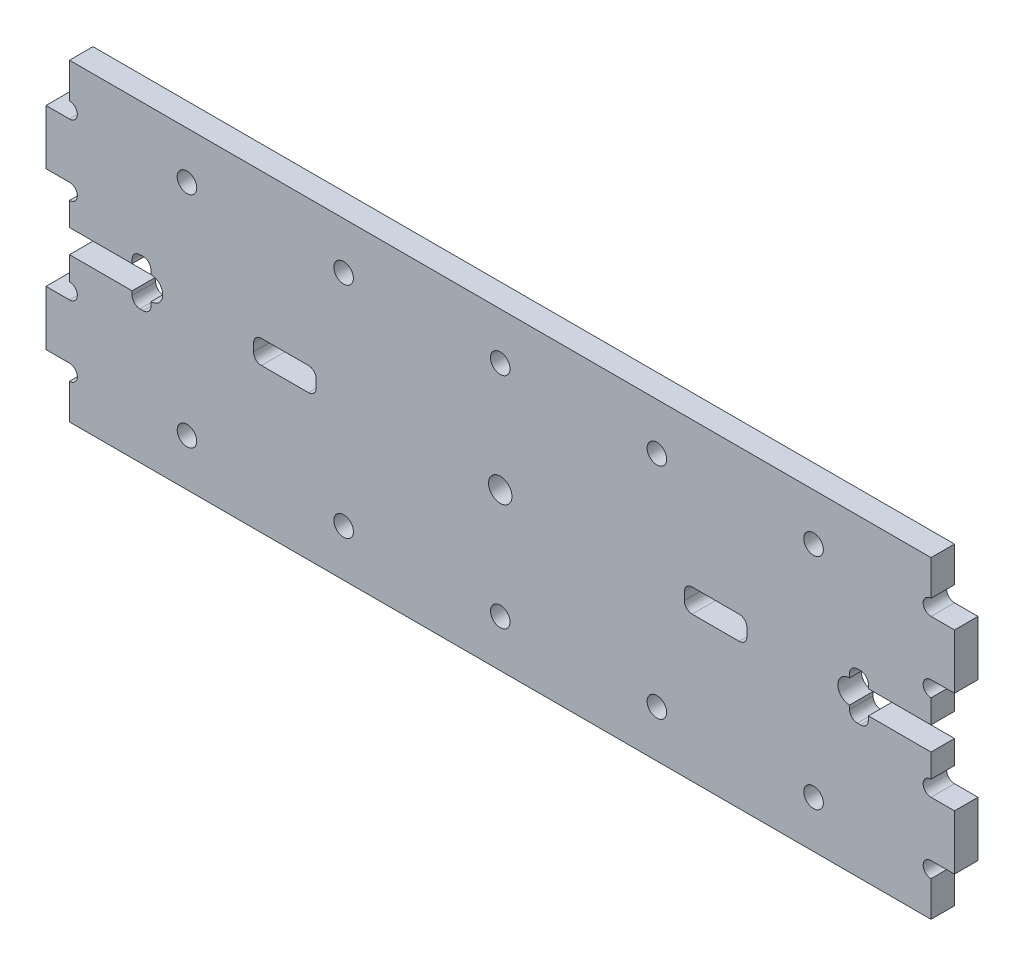
from build123d import *

# Parameters (mm, degrees)
SKETCH1_W           = 110
SKETCH1_H           = 40
BOSS_EXTRUDE1_DEPTH = 3
BOSS_EXTRUDE2_DEPTH = 3
SKETCH3_R           = 1.5
CUT_EXTRUDE1_DEPTH  = 3
SKETCH4_W           = 8
SKETCH4_H           = 3
SKETCH4_W_2         = 2.4
SKETCH4_H_2         = 6
CUT_EXTRUDE2_DEPTH  = 3
FILLET6_R           = 1
SKETCH5_W           = 8
SKETCH5_H           = 3
CUT_EXTRUDE3_DEPTH  = 10
FILLET7_R           = 1
SKETCH6_R           = 1.25
CUT_EXTRUDE4_DEPTH  = 62.424750712


with BuildPart() as part:
    # Sketch1 → Boss-Extrude1 (new body)
    with BuildSketch(Plane.XY):
        Rectangle(SKETCH1_W, SKETCH1_H)
    extrude(amount=BOSS_EXTRUDE1_DEPTH)

    # Sketch2 → Boss-Extrude2 (add)
    with BuildSketch(Plane.XY.offset(3)):
        Polygon((58, 10), (58, 13.5), (55, 13.5), (55, 6.5), (58, 6.5), align=None)
        Polygon((55, -10), (55, -6.5), (58, -6.5), (58, -13.5), (55, -13.5), align=None)
        Polygon((-55, 6.5), (-55, 13.5), (-58, 13.5), (-58, 10), (-58, 6.5), align=None)
        Polygon((-55, -13.5), (-55, -10), (-55, -6.5), (-58, -6.5), (-58, -13.5), align=None)
    extrude(amount=-BOSS_EXTRUDE2_DEPTH)

    # Sketch3 → Cut-Extrude1 (cut)
    with BuildSketch(Plane.XY.offset(3)):
        with BuildLine():
            ThreePointArc((-55, -15.5), (-54.292893219, -15.207106781), (-54, -14.5))
            ThreePointArc((-54, -14.5), (-54.292893219, -13.792893219), (-55, -13.5))
            Line((-55, -13.5), (-55, -15.5))
        make_face()
        with BuildLine():
            Line((-55, -15.5), (-55, -13.5))
            ThreePointArc((-55, -13.5), (-56, -14.5), (-55, -15.5))
        make_face()
        with BuildLine():
            ThreePointArc((-54, -5.5), (-54.292893219, -4.792893219), (-55, -4.5))
            Line((-55, -4.5), (-55, -6.5))
            ThreePointArc((-55, -6.5), (-54.292893219, -6.207106781), (-54, -5.5))
        make_face()
        with BuildLine():
            Line((-55, -6.5), (-55, -4.5))
            ThreePointArc((-55, -4.5), (-56, -5.5), (-55, -6.5))
        make_face()
        with BuildLine():
            ThreePointArc((-55, 4.5), (-54.292893219, 4.792893219), (-54, 5.5))
            ThreePointArc((-54, 5.5), (-54.292893219, 6.207106781), (-55, 6.5))
            Line((-55, 6.5), (-55, 4.5))
        make_face()
        with BuildLine():
            Line((-55, 4.5), (-55, 6.5))
            ThreePointArc((-55, 6.5), (-56, 5.5), (-55, 4.5))
        make_face()
        with BuildLine():
            Line((-55, 15.5), (-55, 13.5))
            ThreePointArc((-55, 13.5), (-54.292893219, 13.792893219), (-54, 14.5))
            ThreePointArc((-54, 14.5), (-54.292893219, 15.207106781), (-55, 15.5))
        make_face()
        with BuildLine():
            ThreePointArc((-55, 15.5), (-56, 14.5), (-55, 13.5))
            Line((-55, 13.5), (-55, 15.5))
        make_face()
        Circle(SKETCH3_R)
        with BuildLine():
            ThreePointArc((56, -5.5), (55.707106781, -4.792893219), (55, -4.5))
            Line((55, -4.5), (55, -6.5))
            ThreePointArc((55, -6.5), (55.707106781, -6.207106781), (56, -5.5))
        make_face()
        with BuildLine():
            Line((55, -6.5), (55, -4.5))
            ThreePointArc((55, -4.5), (54, -5.5), (55, -6.5))
        make_face()
        with BuildLine():
            ThreePointArc((55, -15.5), (55.707106781, -15.207106781), (56, -14.5))
            ThreePointArc((56, -14.5), (55.707106781, -13.792893219), (55, -13.5))
            Line((55, -13.5), (55, -15.5))
        make_face()
        with BuildLine():
            Line((55, -15.5), (55, -13.5))
            ThreePointArc((55, -13.5), (54, -14.5), (55, -15.5))
        make_face()
        with BuildLine():
            ThreePointArc((55, 4.5), (55.707106781, 4.792893219), (56, 5.5))
            ThreePointArc((56, 5.5), (55.707106781, 6.207106781), (55, 6.5))
            Line((55, 6.5), (55, 4.5))
        make_face()
        with BuildLine():
            Line((55, 4.5), (55, 6.5))
            ThreePointArc((55, 6.5), (54, 5.5), (55, 4.5))
        make_face()
        with BuildLine():
            Line((55, 15.5), (55, 13.5))
            ThreePointArc((55, 13.5), (55.707106781, 13.792893219), (56, 14.5))
            ThreePointArc((56, 14.5), (55.707106781, 15.207106781), (55, 15.5))
        make_face()
        with BuildLine():
            ThreePointArc((55, 15.5), (54, 14.5), (55, 13.5))
            Line((55, 13.5), (55, 15.5))
        make_face()
    extrude(amount=-CUT_EXTRUDE1_DEPTH, mode=Mode.SUBTRACT)

    # Sketch4 → Cut-Extrude2 (cut)
    with BuildSketch(Plane.XY.offset(3)):
        with Locations((-51, 0)):
            Rectangle(SKETCH4_W, SKETCH4_H)
        Polygon((-47, 3), (-47, 1.5), (-47, -1.5), (-47, -3), (-44.6, -3), (-44.6, -1.5), (-44.6, 1.5), (-44.6, 3), align=None)
        with BuildLine():
            ThreePointArc((-44.6, -1.5), (-43.1, 0), (-44.6, 1.5))
            Line((-44.6, 1.5), (-44.6, -1.5))
        make_face()
        with Locations((45.8, 0)):
            Rectangle(SKETCH4_W_2, SKETCH4_H_2)
        with BuildLine():
            Line((44.6, -1.5), (44.6, 1.5))
            ThreePointArc((44.6, 1.5), (43.1, 0), (44.6, -1.5))
        make_face()
        with Locations((51, 0)):
            Rectangle(SKETCH4_W, SKETCH4_H)
    extrude(amount=-CUT_EXTRUDE2_DEPTH, mode=Mode.SUBTRACT)

    # Fillet6
    fillet6_edges = [part.edges().sort_by_distance(p)[0] for p in [
        (-47, 3, 1.5),
        (-44.6, 3, 1.5),
        (-44.6, -3, 1.5),
        (-47, -3, 1.5),
        (47, 3, 1.5),
        (47, -3, 1.5),
        (44.6, -3, 1.5),
        (44.6, 3, 1.5),
    ]]
    fillet(fillet6_edges, radius=FILLET6_R)

    # Sketch5 → Cut-Extrude3 (cut)
    with BuildSketch(Plane.XY.offset(3)):
        with Locations((-27.5, 0)):
            Rectangle(SKETCH5_W, SKETCH5_H)
        with Locations((27.5, 0)):
            Rectangle(SKETCH5_W, SKETCH5_H)
    extrude(amount=-CUT_EXTRUDE3_DEPTH, mode=Mode.SUBTRACT)

    # Fillet7
    fillet7_edges = [part.edges().sort_by_distance(p)[0] for p in [
        (-23.5, 1.5, 1.5),
        (-23.5, -1.5, 1.5),
        (-31.5, -1.5, 1.5),
        (-31.5, 1.5, 1.5),
        (31.5, 1.5, 1.5),
        (31.5, -1.5, 1.5),
        (23.5, -1.5, 1.5),
        (23.5, 1.5, 1.5),
    ]]
    fillet(fillet7_edges, radius=FILLET7_R)

    # Sketch6 → Cut-Extrude4 (cut, through all)
    with BuildSketch(Plane.XY.offset(3)):
        with Locations((-40, -14)):
            Circle(SKETCH6_R)
        with Locations((-20, -14)):
            Circle(SKETCH6_R)
        with Locations((0, -14)):
            Circle(SKETCH6_R)
        with Locations((20, -14)):
            Circle(SKETCH6_R)
        with Locations((40, -14)):
            Circle(SKETCH6_R)
        with Locations((40, 14)):
            Circle(SKETCH6_R)
        with Locations((20, 14)):
            Circle(SKETCH6_R)
        with Locations((0, 14)):
            Circle(SKETCH6_R)
        with Locations((-20, 14)):
            Circle(SKETCH6_R)
        with Locations((-40, 14)):
            Circle(SKETCH6_R)
    extrude(amount=-CUT_EXTRUDE4_DEPTH, mode=Mode.SUBTRACT)


solid = part.part
